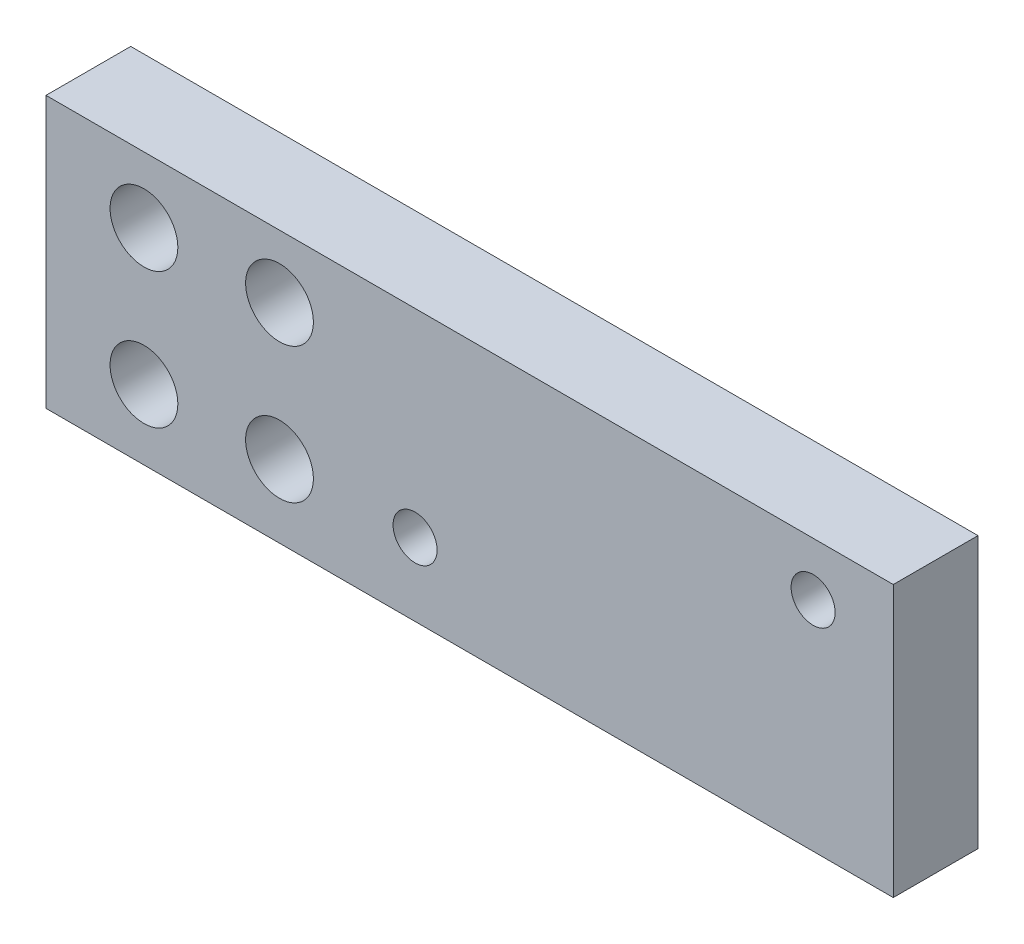
from build123d import *

# Parameters (mm, degrees)
SKETCH_1_W      = 50
SKETCH_1_H      = 16
SKETCH_1_R      = 2
SKETCH_1_R_2    = 1.3
EXTRUDE_1_DEPTH = 5


with BuildPart() as part:
    # 草圖1 → 填料-伸長1 (new body)
    with BuildSketch(Plane.XY):
        with Locations((2.21392494, -4.101485149)):
            Rectangle(SKETCH_1_W, SKETCH_1_H)
        with Locations((-17.00596919, 0.017326733)):
            Circle(SKETCH_1_R, mode=Mode.SUBTRACT)
        with Locations((-17.00596919, -7.982673267)):
            Circle(SKETCH_1_R, mode=Mode.SUBTRACT)
        with Locations((-9.00596919, 0.191523267)):
            Circle(SKETCH_1_R, mode=Mode.SUBTRACT)
        with Locations((-9.00596919, -7.808476733)):
            Circle(SKETCH_1_R, mode=Mode.SUBTRACT)
        with Locations((-1.00596919, -7.808476733)):
            Circle(SKETCH_1_R_2, mode=Mode.SUBTRACT)
        with Locations((22.483938345, 0.748639837)):
            Circle(SKETCH_1_R_2, mode=Mode.SUBTRACT)
    extrude(amount=EXTRUDE_1_DEPTH)


solid = part.part
